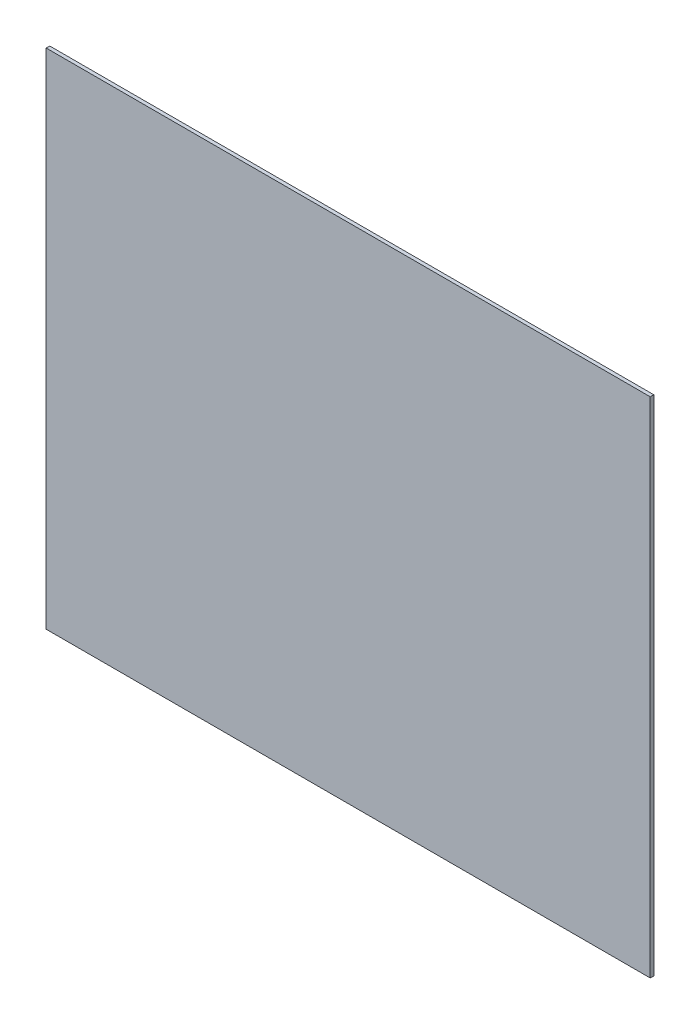
from build123d import *

# Parameters (mm, degrees)
SKICA1_W                = 510
SKICA1_H                = 425
P_IDAT_VYSUNUT_M1_DEPTH = 3


with BuildPart() as part:
    # Skica1 → Přidat vysunutím1 (new body)
    with BuildSketch(Plane.XY):
        Rectangle(SKICA1_W, SKICA1_H)
    extrude(amount=P_IDAT_VYSUNUT_M1_DEPTH)


solid = part.part
